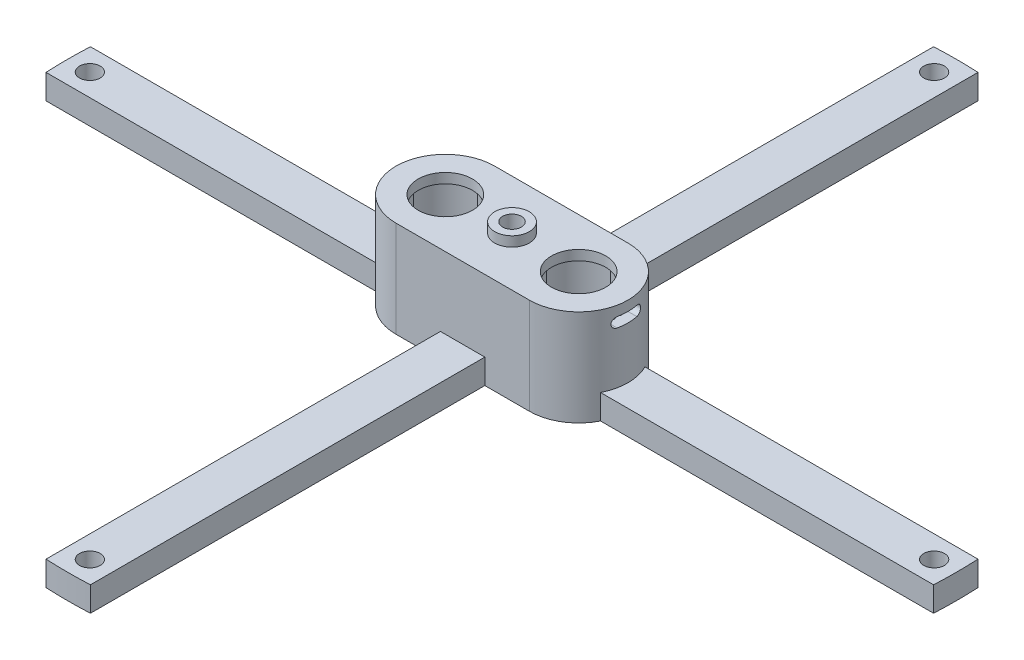
from build123d import *

# Parameters (mm, degrees)
SKETCH1_R             = 1.05
BOSS_EXTRUDE1_DEPTH   = 2.5
SKETCH1_R_2           = 0.95
BOSS_EXTRUDE1_2_DEPTH = 2.5
BOSS_EXTRUDE1_3_DEPTH = 2.5
SKETCH2_R             = 0.95
BOSS_EXTRUDE2_DEPTH   = 9.75
BOSS_EXTRUDE3_START   = -1
SKETCH3_R             = 0.95
SKETCH3_R_2           = 2.75
BOSS_EXTRUDE3_DEPTH   = 1
SKETCH4_R             = 1.75
SKETCH4_R_2           = 0.95
BOSS_EXTRUDE4_DEPTH   = 1
CUT_EXTRUDE3_DEPTH    = 2


with BuildPart() as part:
    # Sketch1 → Boss-Extrude1 (new body)
    with BuildSketch(Plane(origin=(0, 0, 0), x_dir=(1, 0, 0), z_dir=(0, 1, 0))):
        with BuildLine():
            Line((-44.9437148, 2.25), (-11.215142775, 2.25))
            ThreePointArc((-11.215142775, 2.25), (-11.75, 0), (-11.215142775, -2.25))
            Line((-11.215142775, -2.25), (-44.9437148, -2.25))
            ThreePointArc((-44.9437148, -2.25), (-45, 0), (-44.9437148, 2.25))
        make_face()
        with Locations(Location((-42.75, 0, 0), (0, 0, 270))):
            Circle(SKETCH1_R, mode=Mode.SUBTRACT)
    extrude(amount=BOSS_EXTRUDE1_DEPTH)



with BuildPart() as body_2:
    # Sketch1 → Boss-Extrude1 2 (new body)
    with BuildSketch(Plane(origin=(0, 0, 0), x_dir=(1, 0, 0), z_dir=(0, 1, 0))):
        with BuildLine():
            Line((2.25, 44.9437148), (2.25, 5))
            Line((2.25, 5), (6.75, 5))
            ThreePointArc((6.75, 5), (1.75, 0), (6.75, -5))
            Line((6.75, -5), (2.25, -5))
            Line((2.25, -5), (2.25, -44.9437148))
            ThreePointArc((2.25, -44.9437148), (0, -45), (-2.25, -44.9437148))
            Line((-2.25, -44.9437148), (-2.25, -5))
            Line((-2.25, -5), (-6.75, -5))
            ThreePointArc((-6.75, -5), (-1.75, 0), (-6.75, 5))
            Line((-6.75, 5), (-2.25, 5))
            Line((-2.25, 5), (-2.25, 44.9437148))
            ThreePointArc((-2.25, 44.9437148), (0, 45), (2.25, 44.9437148))
        make_face()
        with Locations(Location((0, 0, 0), (0, 0, 270))):
            Circle(SKETCH1_R_2, mode=Mode.SUBTRACT)
        with Locations(Location((0, 42.75, 0), (0, 0, 270))):
            Circle(SKETCH1_R, mode=Mode.SUBTRACT)
        with Locations(Location((0, -42.75, 0), (0, 0, 270))):
            Circle(SKETCH1_R, mode=Mode.SUBTRACT)
    extrude(amount=BOSS_EXTRUDE1_2_DEPTH)


with BuildPart() as body_3:
    # Sketch1 → Boss-Extrude1 3 (new body)
    with BuildSketch(Plane(origin=(0, 0, 0), x_dir=(1, 0, 0), z_dir=(0, 1, 0))):
        with BuildLine():
            Line((44.9437148, -2.25), (11.215142775, -2.25))
            ThreePointArc((11.215142775, -2.25), (11.75, 0), (11.215142775, 2.25))
            Line((11.215142775, 2.25), (44.9437148, 2.25))
            ThreePointArc((44.9437148, 2.25), (45, 0), (44.9437148, -2.25))
        make_face()
        with Locations(Location((42.75, 0, 0), (0, 0, 270))):
            Circle(SKETCH1_R, mode=Mode.SUBTRACT)
    extrude(amount=BOSS_EXTRUDE1_3_DEPTH)


with BuildPart() as part_1:
    add(part.part)

    add(body_2.part)  # Boss-Extrude2 merges body 2

    add(body_3.part)  # Boss-Extrude2 merges body 3
    # Sketch2 → Boss-Extrude2 (add)
    with BuildSketch(Plane(origin=(0, 0, 0), x_dir=(1, 0, 0), z_dir=(0, 1, 0))):
        with BuildLine():
            Line((-6.75, 5), (6.75, 5))
            ThreePointArc((6.75, 5), (11.75, 0), (6.75, -5))
            Line((6.75, -5), (-6.75, -5))
            ThreePointArc((-6.75, -5), (-11.75, 0), (-6.75, 5))
        make_face()
        with Locations(Location((0, 0, 0), (0, 0, 270))):
            Circle(SKETCH2_R, mode=Mode.SUBTRACT)
        with BuildLine():
            Line((-7, 3.992179856), (-7, 3.492179856))
            Line((-7, 3.492179856), (-6.5, 3.492179856))
            Line((-6.5, 3.492179856), (-6.5, 3.992179856))
            ThreePointArc((-6.5, 3.992179856), (-3.921572875, 2.828427125), (-2.757820144, 0.25))
            Line((-2.757820144, 0.25), (-3.257820144, 0.25))
            Line((-3.257820144, 0.25), (-3.257820144, -0.25))
            Line((-3.257820144, -0.25), (-2.757820144, -0.25))
            ThreePointArc((-2.757820144, -0.25), (-3.921572875, -2.828427125), (-6.5, -3.992179856))
            Line((-6.5, -3.992179856), (-6.5, -3.492179856))
            Line((-6.5, -3.492179856), (-7, -3.492179856))
            Line((-7, -3.492179856), (-7, -3.992179856))
            ThreePointArc((-7, -3.992179856), (-9.578427125, -2.828427125), (-10.742179856, -0.25))
            Line((-10.742179856, -0.25), (-10.242179856, -0.25))
            Line((-10.242179856, -0.25), (-10.242179856, 0.25))
            Line((-10.242179856, 0.25), (-10.742179856, 0.25))
            ThreePointArc((-10.742179856, 0.25), (-9.578427125, 2.828427125), (-7, 3.992179856))
        make_face(mode=Mode.SUBTRACT)
        with BuildLine():
            Line((6.5, 3.992179856), (6.5, 3.492179856))
            Line((6.5, 3.492179856), (7, 3.492179856))
            Line((7, 3.492179856), (7, 3.992179856))
            ThreePointArc((7, 3.992179856), (9.578427125, 2.828427125), (10.742179856, 0.25))
            Line((10.742179856, 0.25), (10.242179856, 0.25))
            Line((10.242179856, 0.25), (10.242179856, -0.25))
            Line((10.242179856, -0.25), (10.742179856, -0.25))
            ThreePointArc((10.742179856, -0.25), (9.578427125, -2.828427125), (7, -3.992179856))
            Line((7, -3.992179856), (7, -3.492179856))
            Line((7, -3.492179856), (6.5, -3.492179856))
            Line((6.5, -3.492179856), (6.5, -3.992179856))
            ThreePointArc((6.5, -3.992179856), (3.921572875, -2.828427125), (2.757820144, -0.25))
            Line((2.757820144, -0.25), (3.257820144, -0.25))
            Line((3.257820144, -0.25), (3.257820144, 0.25))
            Line((3.257820144, 0.25), (2.757820144, 0.25))
            ThreePointArc((2.757820144, 0.25), (3.921572875, 2.828427125), (6.5, 3.992179856))
        make_face(mode=Mode.SUBTRACT)
        with BuildLine():
            Line((-3.75, 4), (3.75, 4))
            ThreePointArc((3.75, 4), (2.479758346, 2.600968322), (1.819444444, 0.830434774))
            ThreePointArc((1.819444444, 0.830434774), (0, 2), (-1.819444444, 0.830434774))
            ThreePointArc((-1.819444444, 0.830434774), (-2.479758346, 2.600968322), (-3.75, 4))
        make_face(mode=Mode.SUBTRACT)
        with BuildLine():
            Line((-3.75, -4), (3.75, -4))
            ThreePointArc((3.75, -4), (2.479758346, -2.600968322), (1.819444444, -0.830434774))
            ThreePointArc((1.819444444, -0.830434774), (0, -2), (-1.819444444, -0.830434774))
            ThreePointArc((-1.819444444, -0.830434774), (-2.479758346, -2.600968322), (-3.75, -4))
        make_face(mode=Mode.SUBTRACT)
    extrude(amount=BOSS_EXTRUDE2_DEPTH)

    # Sketch3 → Boss-Extrude3 (add)
    with BuildSketch(Plane(origin=(0, 9.75, 0), x_dir=(1, 0, 0), z_dir=(0, 1, 0)).offset(BOSS_EXTRUDE3_START)):
        with BuildLine():
            Line((-6.75, 5), (6.75, 5))
            ThreePointArc((6.75, 5), (11.75, 0), (6.75, -5))
            Line((6.75, -5), (-6.75, -5))
            ThreePointArc((-6.75, -5), (-11.75, 0), (-6.75, 5))
        make_face()
        with Locations(Location((0, 0, 0), (0, 0, 270))):
            Circle(SKETCH3_R, mode=Mode.SUBTRACT)
        with Locations(Location((-6.75, 0, 0), (0, 0, 270))):
            Circle(SKETCH3_R_2, mode=Mode.SUBTRACT)
        with Locations(Location((6.75, 0, 0), (0, 0, 270))):
            Circle(SKETCH3_R_2, mode=Mode.SUBTRACT)
    extrude(amount=BOSS_EXTRUDE3_DEPTH)

    # Sketch4 → Boss-Extrude4 (add)
    with BuildSketch(Plane(origin=(0, 9.75, 0), x_dir=(1, 0, 0), z_dir=(0, 1, 0))):
        with Locations(Location((0, 0, 0), (0, 0, 270))):
            Circle(SKETCH4_R)
        with Locations(Location((0, 0, 0), (0, 0, 270))):
            Circle(SKETCH4_R_2, mode=Mode.SUBTRACT)
    extrude(amount=BOSS_EXTRUDE4_DEPTH)

    # Sketch7 → Cut-Extrude3 (cut)
    with BuildSketch(Plane(origin=(11.75, 0, 0), x_dir=(0, 0, -1), z_dir=(1, 0, 0))):
        with BuildLine():
            Line((-1, 8.75), (1, 8.75))
            ThreePointArc((1, 8.75), (1.5, 8.25), (1, 7.75))
            Line((1, 7.75), (-1, 7.75))
            ThreePointArc((-1, 7.75), (-1.5, 8.25), (-1, 8.75))
        make_face()
    extrude(amount=-CUT_EXTRUDE3_DEPTH, mode=Mode.SUBTRACT)


solid = part_1.part
